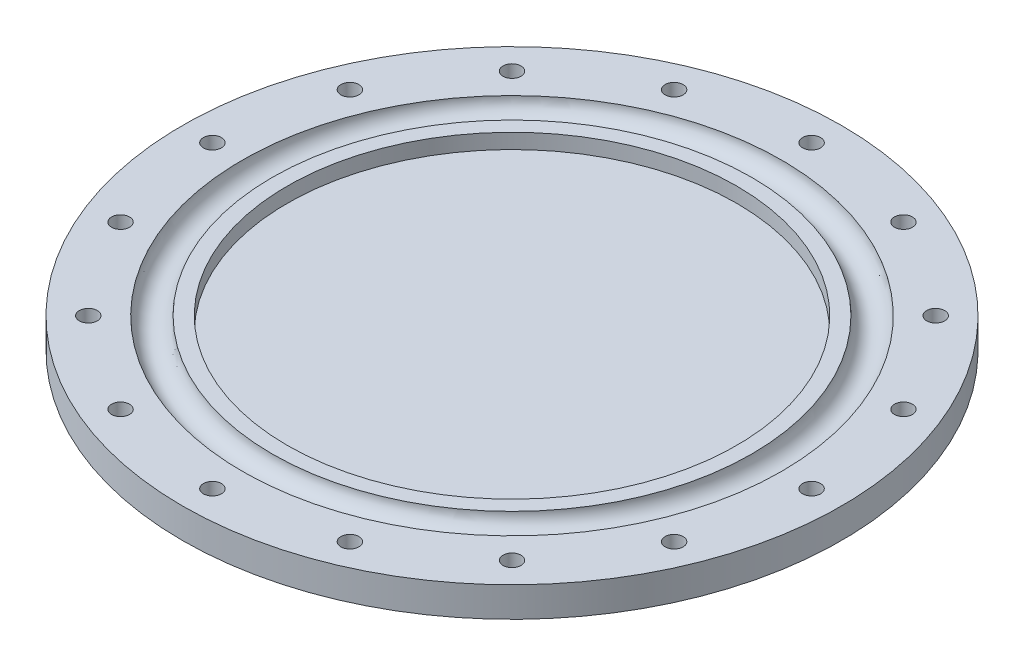
from build123d import *

# Parameters (mm, degrees)
SKETCH_1_R        = 80
SKETCH_1_R_2      = 75
EXTRUDE_1_DEPTH   = 10
SKETCH_1_R_3      = 110
SKETCH_1_R_4      = 3
SKETCH_1_R_5      = 90
EXTRUDE_1_2_DEPTH = 10
SKETCH_1_3_R      = 90
SKETCH_1_3_R_2    = 80
SKETCH_1_3_R_3    = 75
EXTRUDE_2_DEPTH   = 5
SKETCH_2_R        = 90
SKETCH_2_R_2      = 80
EXTRUDE_4_DEPTH   = 5


with BuildPart() as part:
    # 草图1 → 凸台-拉伸1 (new body)
    with BuildSketch(Plane(origin=(0, 0, 0), x_dir=(1, 0, 0), z_dir=(0, 1, 0))):
        Circle(SKETCH_1_R)
        Circle(SKETCH_1_R_2, mode=Mode.SUBTRACT)
    extrude(amount=EXTRUDE_1_DEPTH)



with BuildPart() as body_2:
    # 草图1 → Extrude 1 2 (new body)
    with BuildSketch(Plane(origin=(0, 0, 0), x_dir=(1, 0, 0), z_dir=(0, 1, 0))):
        Circle(SKETCH_1_R_3)
        with Locations((-70.710678119, -70.710678119)):
            Circle(SKETCH_1_R_4, mode=Mode.SUBTRACT)
        with Locations((-38.268343237, -92.387953251)):
            Circle(SKETCH_1_R_4, mode=Mode.SUBTRACT)
        with Locations((-92.387953251, -38.268343237)):
            Circle(SKETCH_1_R_4, mode=Mode.SUBTRACT)
        with Locations((-100, 0)):
            Circle(SKETCH_1_R_4, mode=Mode.SUBTRACT)
        with Locations((0, -100)):
            Circle(SKETCH_1_R_4, mode=Mode.SUBTRACT)
        with Locations((38.268343237, -92.387953251)):
            Circle(SKETCH_1_R_4, mode=Mode.SUBTRACT)
        with Locations((70.710678119, -70.710678119)):
            Circle(SKETCH_1_R_4, mode=Mode.SUBTRACT)
        with Locations((92.387953251, -38.268343237)):
            Circle(SKETCH_1_R_4, mode=Mode.SUBTRACT)
        with Locations((-92.387953251, 38.268343237)):
            Circle(SKETCH_1_R_4, mode=Mode.SUBTRACT)
        with Locations((-70.710678119, 70.710678119)):
            Circle(SKETCH_1_R_4, mode=Mode.SUBTRACT)
        with Locations((-38.268343237, 92.387953251)):
            Circle(SKETCH_1_R_4, mode=Mode.SUBTRACT)
        Circle(SKETCH_1_R_5, mode=Mode.SUBTRACT)
        with Locations((100, 0)):
            Circle(SKETCH_1_R_4, mode=Mode.SUBTRACT)
        with Locations((92.387953251, 38.268343237)):
            Circle(SKETCH_1_R_4, mode=Mode.SUBTRACT)
        with Locations((0, 100)):
            Circle(SKETCH_1_R_4, mode=Mode.SUBTRACT)
        with Locations((38.268343237, 92.387953251)):
            Circle(SKETCH_1_R_4, mode=Mode.SUBTRACT)
        with Locations((70.710678119, 70.710678119)):
            Circle(SKETCH_1_R_4, mode=Mode.SUBTRACT)
    extrude(amount=EXTRUDE_1_2_DEPTH)


with BuildPart() as part_1:
    add(part.part)

    add(body_2.part)  # 凸台-拉伸2 merges body 2
    # 草图1<3> → 凸台-拉伸2 (add)
    # profile 1 of 2: a face of its own
    with BuildSketch(Plane(origin=(0, 0, 0), x_dir=(1, 0, 0), z_dir=(0, 1, 0))):
        Circle(SKETCH_1_3_R)
        Circle(SKETCH_1_3_R_2, mode=Mode.SUBTRACT)
    # profile 2 of 2: a face of its own
    with BuildSketch(Plane(origin=(0, 0, 0), x_dir=(1, 0, 0), z_dir=(0, 1, 0))):
        Circle(SKETCH_1_3_R_3)
    extrude(amount=EXTRUDE_2_DEPTH)

    # 草图2 → 凸台-拉伸4 (add)
    with BuildSketch(Plane(origin=(0, 5, 0), x_dir=(1, 0, 0), z_dir=(0, 1, 0))):
        Circle(SKETCH_2_R)
        Circle(SKETCH_2_R_2, mode=Mode.SUBTRACT)
    extrude(amount=EXTRUDE_4_DEPTH)

    # 切除-扫描1: sweep along a path in 草图5
    with BuildLine(Plane(origin=(0, 5, 0), x_dir=(1, 0, 0), z_dir=(0, 1, 0))) as sweep_1_path:
        CenterArc((0, 0), 85, 0, 360)
    # 草图4 → 切除-扫描1 (sweep, cut)
    with BuildSketch(Plane.XY):
        with BuildLine():
            Line((90, 10), (80, 10))
            ThreePointArc((80, 10), (85, 5), (90, 10))
        make_face()
    sweep(path=sweep_1_path.line, mode=Mode.SUBTRACT)


solid = part_1.part
